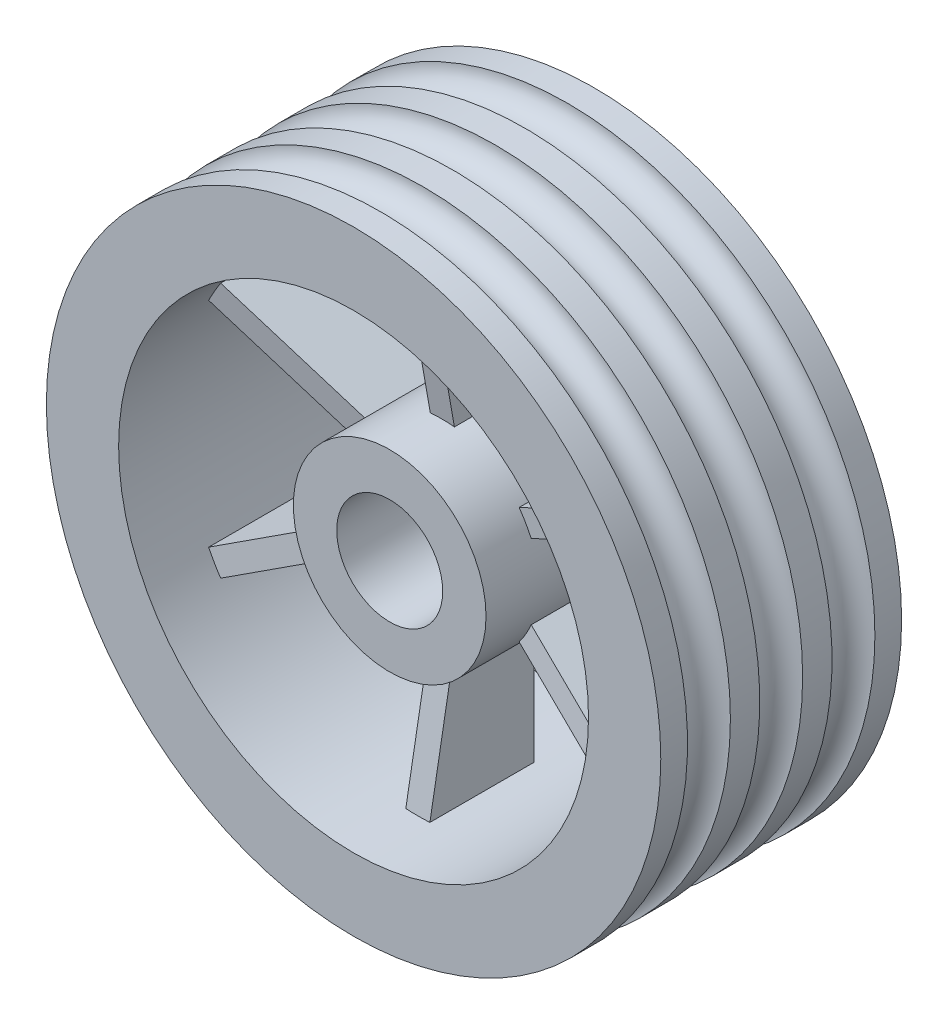
from build123d import *

# Parameters (mm, degrees)
SKETCH1_R                = 12.755
SKETCH1_R_2              = 9.755
BOSS_EXTRUDE1_DEPTH      = 10
BOSS_EXTRUDE2_DEPTH      = 8.5
BOSS_EXTRUDE2_DEPTH_BACK = 0.5
SKETCH2_R                = 4
SKETCH2_R_2              = 2.2
BOSS_EXTRUDE3_DEPTH      = 0.5
CIRPATTERN1_COUNT        = 6
SKETCH7_R                = 0.89


with BuildPart() as part:
    # Sketch1 → Boss-Extrude1 (new body)
    with BuildSketch(Plane.XY):
        Circle(SKETCH1_R)
        Circle(SKETCH1_R_2, mode=Mode.SUBTRACT)
    extrude(amount=BOSS_EXTRUDE1_DEPTH)



with BuildPart() as body_2:
    # Sketch2 → Boss-Extrude2 (new, two sides: drawn at the far end of the back side and taken through both)
    with BuildSketch(Plane.XY.offset(-BOSS_EXTRUDE2_DEPTH_BACK)):
        Circle(SKETCH2_R)
        Circle(SKETCH2_R_2, mode=Mode.SUBTRACT)
    extrude(amount=BOSS_EXTRUDE2_DEPTH + BOSS_EXTRUDE2_DEPTH_BACK)


with BuildPart() as part_1:
    add(part.part)

    add(body_2.part)  # Boss-Extrude3 merges body 2
    # Sketch5 → Boss-Extrude3 (add, symmetric)
    with BuildSketch(Plane(origin=(0, 0, 0), x_dir=(0, 0, -1), z_dir=(1, 0, 0))):
        Polygon((-3, 2.2), (-3, 10.7), (-7.5, 10.7), (-6, 2.2), align=None)
    boss_extrude3 = extrude(amount=BOSS_EXTRUDE3_DEPTH, both=True)

    # CirPattern1: Boss-Extrude3 ×6 about axis
    cirpattern1_axis = Axis((0, 0, -0.5), (0, 0, 1))
    for i in range(1, CIRPATTERN1_COUNT):
        add(boss_extrude3.rotate(cirpattern1_axis, i * 360 / CIRPATTERN1_COUNT))

    # Sketch7 → Cut-Revolve1 (revolve, cut)
    with BuildSketch(Plane(origin=(0, 0, 0), x_dir=(0, 0, -1), z_dir=(1, 0, 0))):
        with Locations((-5, 12.755)):
            Circle(SKETCH7_R)
        with Locations((-2, 12.755)):
            Circle(SKETCH7_R)
        with Locations((-8, 12.755)):
            Circle(SKETCH7_R)
    revolve(axis=Axis((0, 0, 0), (0, 0, 1)), mode=Mode.SUBTRACT)


solid = part_1.part
